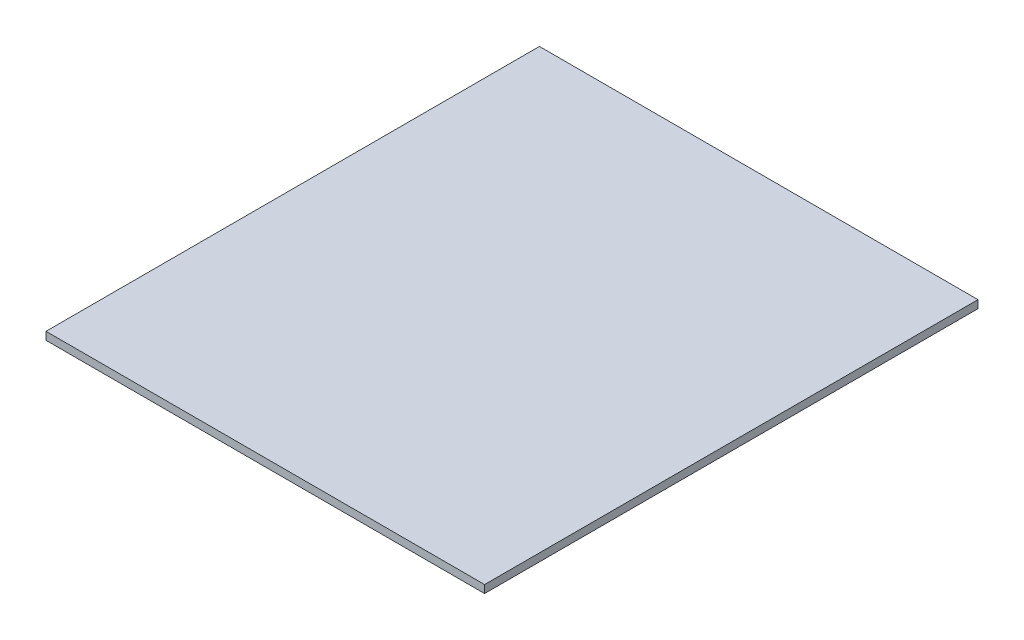
from build123d import *

# Parameters (mm, degrees)
SKETCH1_W           = 355.6
SKETCH1_H           = 400.05
BOSS_EXTRUDE1_DEPTH = 6.35


with BuildPart() as part:
    # Sketch1 → Boss-Extrude1 (new body)
    with BuildSketch(Plane(origin=(0, 0, 0), x_dir=(1, 0, 0), z_dir=(0, 1, 0))):
        with Locations((177.8, 200.025)):
            Rectangle(SKETCH1_W, SKETCH1_H)
    extrude(amount=BOSS_EXTRUDE1_DEPTH)


solid = part.part
